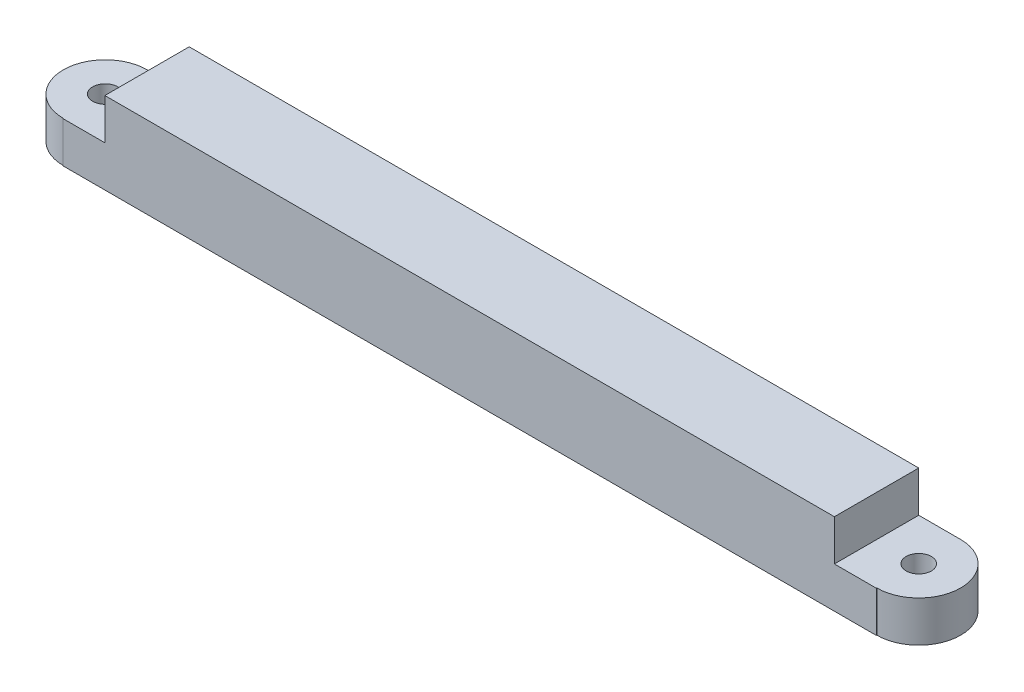
from build123d import *

# Parameters (mm, degrees)
BOSS_EXTRUDE1_DEPTH = 9.75
CUT_EXTRUDE3_START  = -4.875
CUT_EXTRUDE3_DEPTH  = 4.875


with BuildPart() as part:
    # Sketch1 → Boss-Extrude1 (new body)
    with BuildSketch(Plane(origin=(0, 0, 0), x_dir=(1, 0, 0), z_dir=(0, 1, 0))):
        with BuildLine():
            Line((0, 5), (0, 0))
            Line((0, 0), (43.45, 0))
            ThreePointArc((43.45, 0), (44.914466094, 3.535533906), (48.45, 5))
            Line((48.45, 5), (0, 5))
        make_face()
        with BuildLine():
            Line((43.45, 0), (0, 0))
            Line((0, 0), (0, -5.049027621))
            Line((0, -5.049027621), (48.45, -5.049027621))
            Line((48.45, -5.049027621), (48.45, -5))
            ThreePointArc((48.45, -5), (44.914466094, -3.535533906), (43.45, 0))
        make_face()
        with BuildLine():
            ThreePointArc((53.45, 0), (51.985533906, 3.535533906), (48.45, 5))
            Line((48.45, 5), (48.45, 1.5))
            ThreePointArc((48.45, 1.5), (49.510660172, 1.060660172), (49.95, 0))
            ThreePointArc((49.95, 0), (49.510660172, -1.060660172), (48.45, -1.5))
            Line((48.45, -1.5), (48.45, -5))
            ThreePointArc((48.45, -5), (51.985533906, -3.535533906), (53.45, 0))
        make_face()
        with BuildLine():
            ThreePointArc((48.45, 5), (44.914466094, 3.535533906), (43.45, 0))
            Line((43.45, 0), (46.95, 0))
            ThreePointArc((46.95, 0), (47.389339828, 1.060660172), (48.45, 1.5))
            Line((48.45, 1.5), (48.45, 5))
        make_face()
        with BuildLine():
            Line((46.95, 0), (43.45, 0))
            ThreePointArc((43.45, 0), (44.914466094, -3.535533906), (48.45, -5))
            Line((48.45, -5), (48.45, -1.5))
            ThreePointArc((48.45, -1.5), (47.389339828, -1.060660172), (46.95, 0))
        make_face()
    boss_extrude1 = extrude(amount=BOSS_EXTRUDE1_DEPTH)

    # Mirror1: Boss-Extrude1 across plane
    add(boss_extrude1.mirror(Plane(origin=(0, 0, 0), x_dir=(0, 0, 1), z_dir=(1, 0, 0))))

    # Sketch2 → Cut-Extrude3 (cut)
    with BuildSketch(Plane(origin=(0, 9.75, 0), x_dir=(1, 0, 0), z_dir=(0, 1, 0)).offset(CUT_EXTRUDE3_START)):
        with BuildLine():
            Line((49.95, 0), (53.45, 0))
            ThreePointArc((53.45, 0), (51.985533906, 3.535533906), (48.45, 5))
            Line((48.45, 5), (43.45, 5))
            Line((43.45, 5), (43.45, 0))
            Line((43.45, 0), (46.95, 0))
            ThreePointArc((46.95, 0), (48.45, 1.5), (49.95, 0))
        make_face()
        with BuildLine():
            ThreePointArc((48.45, -5), (51.985533906, -3.535533906), (53.45, 0))
            Line((53.45, 0), (49.95, 0))
            ThreePointArc((49.95, 0), (48.45, -1.5), (46.95, 0))
            Line((46.95, 0), (43.45, 0))
            Line((43.45, 0), (43.45, -5.049027621))
            Line((43.45, -5.049027621), (48.45, -5.049027621))
            Line((48.45, -5.049027621), (48.45, -5))
        make_face()
    cut_extrude3 = extrude(amount=CUT_EXTRUDE3_DEPTH, mode=Mode.SUBTRACT)

    # Mirror2: Cut-Extrude3 across plane
    add(cut_extrude3.mirror(Plane(origin=(0, 0, 0), x_dir=(0, 0, 1), z_dir=(1, 0, 0))), mode=Mode.SUBTRACT)


solid = part.part
